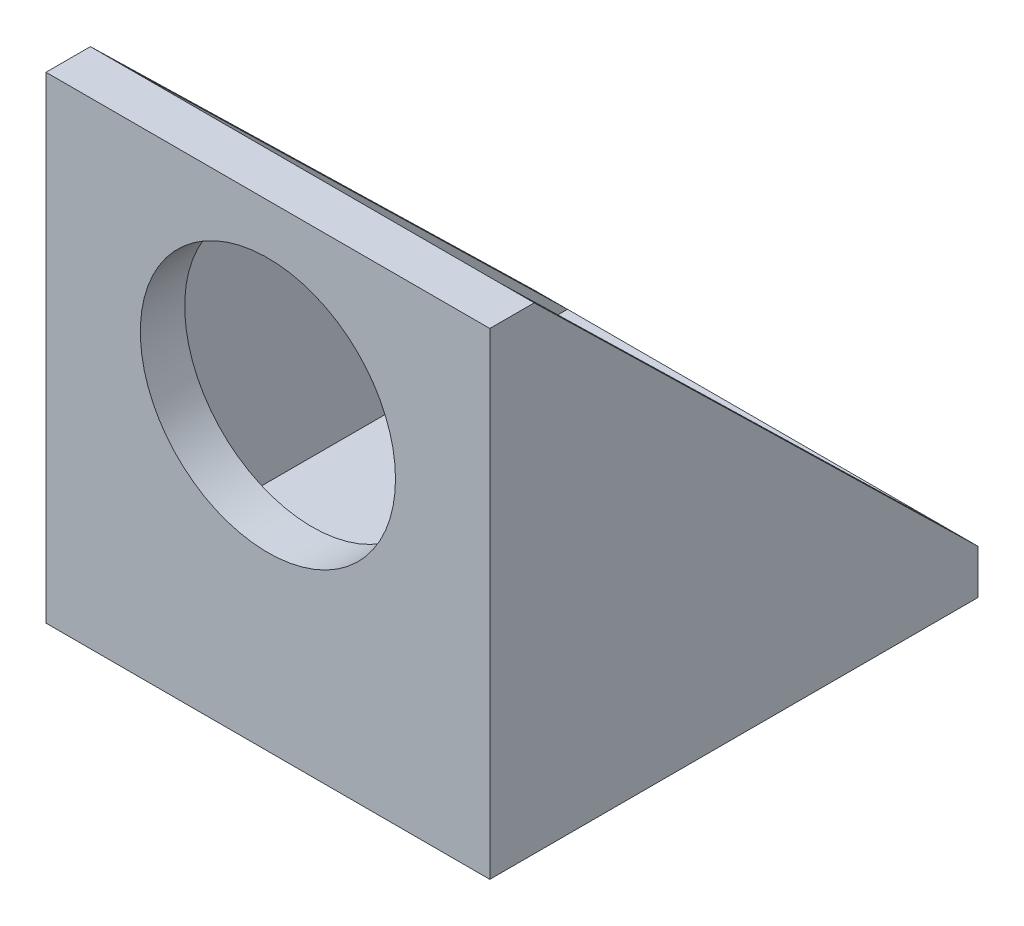
from build123d import *

# Parameters (mm, degrees)
SKETCH_1_W           = 34
SKETCH_1_H           = 51
EXTRUDE_1_DEPTH      = 4
SKETCH_2_R           = 11.5
CUT_EXTRUDE_1_DEPTH  = 31.907118921
SKETCH_5_W           = 34
SKETCH_5_H           = 15
EXTRUDE_2_DEPTH      = 4
SKETCH_6_R           = 1.5
CUT_EXTRUDE_3_DEPTH  = 4
SKETCH_12_W          = 34
SKETCH_12_H          = 4
CUT_EXTRUDE_5_DEPTH  = 5
SKETCH_13_W          = 34
SKETCH_13_H          = 4
CUT_EXTRUDE_6_DEPTH  = 7
SKETCH_14_W          = 34
SKETCH_14_H          = 4
EXTRUDE_3_DEPTH      = 33
SKETCH_15_R          = 1.75
CUT_EXTRUDE_7_DEPTH  = 44
EXTRUDE_4_DEPTH      = 3
EXTRUDE_5_DEPTH      = 3
SKETCH_18_R          = 1.75
EXTRUDE_6_DEPTH      = 4
EXTRUDE_7_DEPTH      = 5
SKETCH_20_W          = 63.510352062
SKETCH_20_H          = 72.285945639
CUT_EXTRUDE_10_DEPTH = 67
SKETCH_21_W          = 4
SKETCH_21_H          = 43
EXTRUDE_8_DEPTH      = 3
SKETCH_22_W          = 4
SKETCH_22_H          = 43
EXTRUDE_9_DEPTH      = 3
SKETCH_23_W          = 40
SKETCH_23_H          = 4
EXTRUDE_10_DEPTH     = 40
SKETCH_24_W          = 3
SKETCH_24_H          = 39
EXTRUDE_11_DEPTH     = 40
CUT_EXTRUDE_11_DEPTH = 72.5
SKETCH_26_R          = 1.75
CUT_EXTRUDE_12_DEPTH = 5


with BuildPart() as part:
    # 草图1 → 凸台-拉伸1 (new body)
    with BuildSketch(Plane.XY):
        Rectangle(SKETCH_1_W, SKETCH_1_H)
    extrude(amount=EXTRUDE_1_DEPTH)

    # 草图2 → 切除-拉伸1 (cut, through all)
    with BuildSketch(Plane.XY.offset(4)):
        with Locations((0, -2.5)):
            Circle(SKETCH_2_R)
    extrude(amount=-CUT_EXTRUDE_1_DEPTH, mode=Mode.SUBTRACT)

    # 草图5 → 凸台-拉伸2 (add)
    with BuildSketch(Plane.XZ.offset(25.5)):
        with Locations((0, 7.5)):
            Rectangle(SKETCH_5_W, SKETCH_5_H)
    extrude(amount=EXTRUDE_2_DEPTH)

    # 草图6 → 切除-拉伸3 (cut)
    with BuildSketch(Plane.XZ.offset(29.5)):
        with Locations(Location((13, 7.5, 0), (0, 0, 270))):
            Circle(SKETCH_6_R)
        with Locations(Location((-13, 7.5, 0), (0, 0, 90))):
            Circle(SKETCH_6_R)
    extrude(amount=-CUT_EXTRUDE_3_DEPTH, mode=Mode.SUBTRACT)

    # 草图12 → 切除-拉伸5 (cut)
    with BuildSketch(Plane(origin=(0, 25.5, 0), x_dir=(1, 0, 0), z_dir=(0, 1, 0))):
        with Locations((0, -2)):
            Rectangle(SKETCH_12_W, SKETCH_12_H)
    extrude(amount=-CUT_EXTRUDE_5_DEPTH, mode=Mode.SUBTRACT)

    # 草图13 → 切除-拉伸6 (cut)
    with BuildSketch(Plane(origin=(0, 20.5, 0), x_dir=(1, 0, 0), z_dir=(0, 1, 0))):
        with Locations((0, -2)):
            Rectangle(SKETCH_13_W, SKETCH_13_H)
    extrude(amount=-CUT_EXTRUDE_6_DEPTH, mode=Mode.SUBTRACT)

    # 草图14 → 凸台-拉伸3 (add)
    with BuildSketch(Plane.XY.offset(15)):
        with Locations((0, -27.5)):
            Rectangle(SKETCH_14_W, SKETCH_14_H)
    extrude(amount=EXTRUDE_3_DEPTH)

    # 草图15 → 切除-拉伸7 (cut)
    with BuildSketch(Plane(origin=(0, -25.5, 0), x_dir=(1, 0, 0), z_dir=(0, 1, 0))):
        with Locations(Location((13, -40.5, 0), (0, 0, 270))):
            Circle(SKETCH_15_R)
        with Locations(Location((-13, -40.5, 0), (0, 0, 270))):
            Circle(SKETCH_15_R)
    extrude(amount=-CUT_EXTRUDE_7_DEPTH, mode=Mode.SUBTRACT)

    # 草图16 → 凸台-拉伸4 (add)
    with BuildSketch(Plane.ZY.offset(17)):
        Polygon((4, -25.5), (4, -6), (24, -25.5), align=None)
    extrude(amount=-EXTRUDE_4_DEPTH)

    # 草图17 → 凸台-拉伸5 (add)
    with BuildSketch(Plane(origin=(17, 0, 0), x_dir=(0, 0, -1), z_dir=(1, 0, 0))):
        Polygon((-24, -25.5), (-4, -6), (-4, -25.5), align=None)
    extrude(amount=-EXTRUDE_5_DEPTH)

    # 草图18 → 凸台-拉伸6 (add)
    with BuildSketch(Plane(origin=(0, -25.5, 0), x_dir=(1, 0, 0), z_dir=(0, 1, 0))):
        with BuildLine():
            Line((20.499000769, -32.499999751), (17, -24))
            Line((17, -24), (-17, -24))
            Line((-17, -24), (-20.500999231, -32.499999751))
            Line((-20.500999231, -32.499999751), (-20.500999231, -40.499999751))
            ThreePointArc((-20.500999231, -40.499999751), (-17.718513652, -47.217514172), (-11.000999231, -49.999999751))
            Line((-11.000999231, -49.999999751), (10.999000769, -49.999999751))
            ThreePointArc((10.999000769, -49.999999751), (17.71651519, -47.217514172), (20.499000769, -40.499999751))
            Line((20.499000769, -40.499999751), (20.499000769, -32.499999751))
        make_face()
        with Locations(Location((-13, -40.5, 0), (0, 0, 270))):
            Circle(SKETCH_18_R, mode=Mode.SUBTRACT)
        with Locations(Location((13, -40.5, 0), (0, 0, 270))):
            Circle(SKETCH_18_R, mode=Mode.SUBTRACT)
    extrude(amount=-EXTRUDE_6_DEPTH)

    # 草图19 → 凸台-拉伸7 (add)
    with BuildSketch(Plane(origin=(0, -25.5, 0), x_dir=(1, 0, 0), z_dir=(0, 1, 0))):
        Polygon((-20.500999231, -32.499999751), (-17.500999231, -32.499999751), (-14, -24), (-14, -16), (-17, -16), (-17, -24), align=None)
        Polygon((17, -24), (20.499000769, -32.499999751), (17.499000769, -32.499999751), (14, -24), (14, -16), (17, -16), align=None)
    extrude(amount=EXTRUDE_7_DEPTH)

    # 草图20 → 切除-拉伸10 (cut)
    with BuildSketch(Plane.XY.offset(4)):
        with Locations((0, -7.757033155)):
            Rectangle(SKETCH_20_W, SKETCH_20_H)
    extrude(amount=CUT_EXTRUDE_10_DEPTH, mode=Mode.SUBTRACT)

    # 草图21 → 凸台-拉伸8 (add)
    with BuildSketch(Plane(origin=(17, 0, 0), x_dir=(0, 0, -1), z_dir=(1, 0, 0))):
        with Locations((-2, -8)):
            Rectangle(SKETCH_21_W, SKETCH_21_H)
    extrude(amount=EXTRUDE_8_DEPTH)

    # 草图22 → 凸台-拉伸9 (add)
    with BuildSketch(Plane.ZY.offset(17)):
        with Locations((2, -8)):
            Rectangle(SKETCH_22_W, SKETCH_22_H)
    extrude(amount=EXTRUDE_9_DEPTH)

    # 草图23 → 凸台-拉伸10 (add)
    with BuildSketch(Plane(origin=(0, 0, 0), x_dir=(-1, 0, 0), z_dir=(0, 0, -1))):
        with Locations((0, -27.5)):
            Rectangle(SKETCH_23_W, SKETCH_23_H)
    extrude(amount=EXTRUDE_10_DEPTH)

    # 草图24 → 凸台-拉伸11 (add)
    with BuildSketch(Plane(origin=(0, 0, 0), x_dir=(-1, 0, 0), z_dir=(0, 0, -1))):
        with Locations((18.5, -6)):
            Rectangle(SKETCH_24_W, SKETCH_24_H)
        with Locations((-18.5, -6)):
            Rectangle(SKETCH_24_W, SKETCH_24_H)
    extrude(amount=EXTRUDE_11_DEPTH)

    # 草图25 → 切除-拉伸11 (cut, symmetric)
    with BuildSketch(Plane(origin=(-17, 0, 0), x_dir=(0, 0, -1), z_dir=(1, 0, 0))):
        Polygon((0, 13.5), (40, -25.5), (40, 13.5), align=None)
    extrude(amount=CUT_EXTRUDE_11_DEPTH, both=True, mode=Mode.SUBTRACT)

    # 草图26 → 切除-拉伸12 (cut)
    with BuildSketch(Plane(origin=(0, -25.5, 0), x_dir=(1, 0, 0), z_dir=(0, 1, 0))):
        with Locations(Location((-12.5, 32, 0), (0, 0, 270))):
            Circle(SKETCH_26_R)
        with Locations(Location((12.5, 32, 0), (0, 0, 270))):
            Circle(SKETCH_26_R)
        with Locations(Location((12.5, 8, 0), (0, 0, 270))):
            Circle(SKETCH_26_R)
        with Locations(Location((-12.5, 8, 0), (0, 0, 270))):
            Circle(SKETCH_26_R)
    extrude(amount=-CUT_EXTRUDE_12_DEPTH, mode=Mode.SUBTRACT)


solid = part.part
